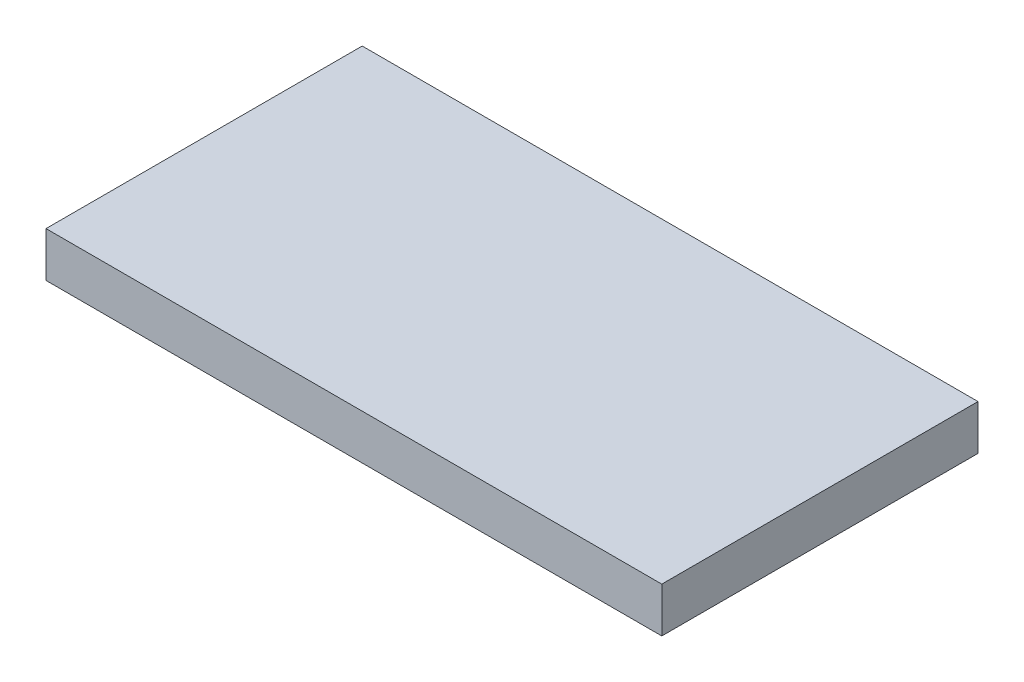
from build123d import *

# Parameters (mm, degrees)
SKETCH1_W           = 370
SKETCH1_H           = 190
BOSS_EXTRUDE1_DEPTH = 27


with BuildPart() as part:
    # Sketch1 → Boss-Extrude1 (new body)
    with BuildSketch(Plane(origin=(0, 0, 0), x_dir=(1, 0, 0), z_dir=(0, 1, 0))):
        with Locations((185, -95)):
            Rectangle(SKETCH1_W, SKETCH1_H)
    extrude(amount=BOSS_EXTRUDE1_DEPTH)


solid = part.part
